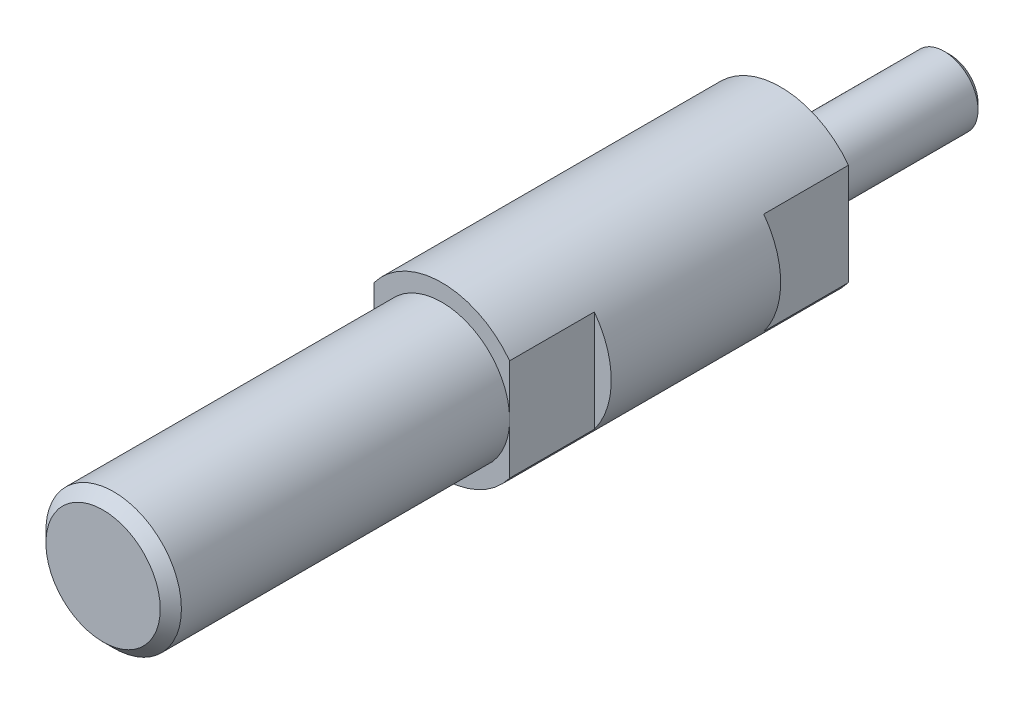
from build123d import *

# Parameters (mm, degrees)
ESBO_O2_R                  = 5
RESSALTO_EXTRUS_O1_DEPTH   = 20
ESBO_O3_R                  = 4
RESSALTO_EXTRUS_O2_DEPTH   = 20
ESBO_O4_R                  = 2
RESSALTO_EXTRUS_O3_DEPTH   = 10
CHANFRO1_SIZE              = 0.625
CHANFRO2_SIZE              = 0.35
CORTE_EXTRUS_O2_DEPTH      = 31.822070015
CORTE_EXTRUS_O2_DEPTH_BACK = 31.822070015
ESBO_O6_W                  = 1
ESBO_O6_H                  = 5


with BuildPart() as part:
    # Esboço2 → Ressalto-extrusão1 (new body)
    with BuildSketch(Plane.XY):
        Circle(ESBO_O2_R)
    extrude(amount=-RESSALTO_EXTRUS_O1_DEPTH)

    # Esboço3 → Ressalto-extrusão2 (add)
    with BuildSketch(Plane.XY):
        Circle(ESBO_O3_R)
    extrude(amount=RESSALTO_EXTRUS_O2_DEPTH)

    # Esboço4 → Ressalto-extrusão3 (add)
    with BuildSketch(Plane(origin=(0, 0, -20), x_dir=(-1, 0, 0), z_dir=(0, 0, -1))):
        Circle(ESBO_O4_R)
    extrude(amount=RESSALTO_EXTRUS_O3_DEPTH)

    # Chanfro1
    chanfro1_edges = [part.edges().sort_by_distance(p)[0] for p in [
        (-4, 0, 20),
    ]]
    chamfer(chanfro1_edges, length=CHANFRO1_SIZE)

    # Chanfro2
    chanfro2_edges = [part.edges().sort_by_distance(p)[0] for p in [
        (2, 0, -30),
    ]]
    chamfer(chanfro2_edges, length=CHANFRO2_SIZE)

    # Esboço6 → Corte-extrusão2 (cut, two sides: drawn at the far end of the back side and taken through both)
    with BuildSketch(Plane(origin=(0, 0, 0), x_dir=(1, 0, 0), z_dir=(0, 1, 0)).offset(-CORTE_EXTRUS_O2_DEPTH_BACK)):
        with Locations((-4.5, 17.5)):
            Rectangle(ESBO_O6_W, ESBO_O6_H)
        with Locations((-4.5, 2.5)):
            Rectangle(ESBO_O6_W, ESBO_O6_H)
        with Locations((4.5, 17.5)):
            Rectangle(ESBO_O6_W, ESBO_O6_H)
        with Locations((4.5, 2.5)):
            Rectangle(ESBO_O6_W, ESBO_O6_H)
    extrude(amount=CORTE_EXTRUS_O2_DEPTH + CORTE_EXTRUS_O2_DEPTH_BACK, mode=Mode.SUBTRACT)


solid = part.part
